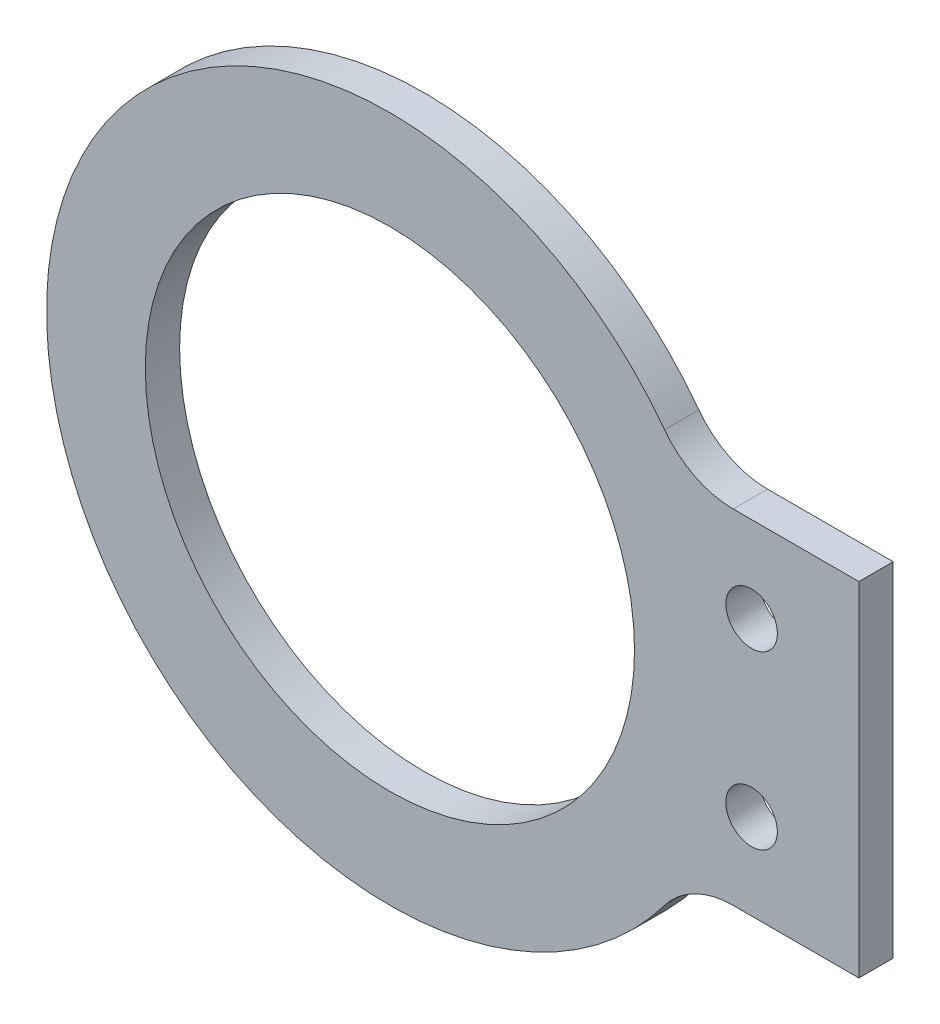
from build123d import *

# Parameters (mm, degrees)
ESQUISSE2_R        = 28.5
ESQUISSE2_R_2      = 3
BOSS_EXTRU_1_DEPTH = 4


with BuildPart() as part:
    # Esquisse2 → Boss.-Extru.1 (new body)
    with BuildSketch(Plane.XY):
        with BuildLine():
            Line((40, 20), (54.641016151, 20))
            Line((54.641016151, 20), (54.641016151, -20))
            Line((54.641016151, -20), (40, -20))
            ThreePointArc((40, -20), (35.527864045, -21.05572809), (32, -24))
            ThreePointArc((32, -24), (-40, 0), (32, 24))
            ThreePointArc((32, 24), (35.527864045, 21.05572809), (40, 20))
        make_face()
        Circle(ESQUISSE2_R, mode=Mode.SUBTRACT)
        with Locations((42.141016151, 10)):
            Circle(ESQUISSE2_R_2, mode=Mode.SUBTRACT)
        with Locations(Location((42.141016151, -10, 0), (0, 0, 180))):
            Circle(ESQUISSE2_R_2, mode=Mode.SUBTRACT)
    extrude(amount=BOSS_EXTRU_1_DEPTH)


solid = part.part
